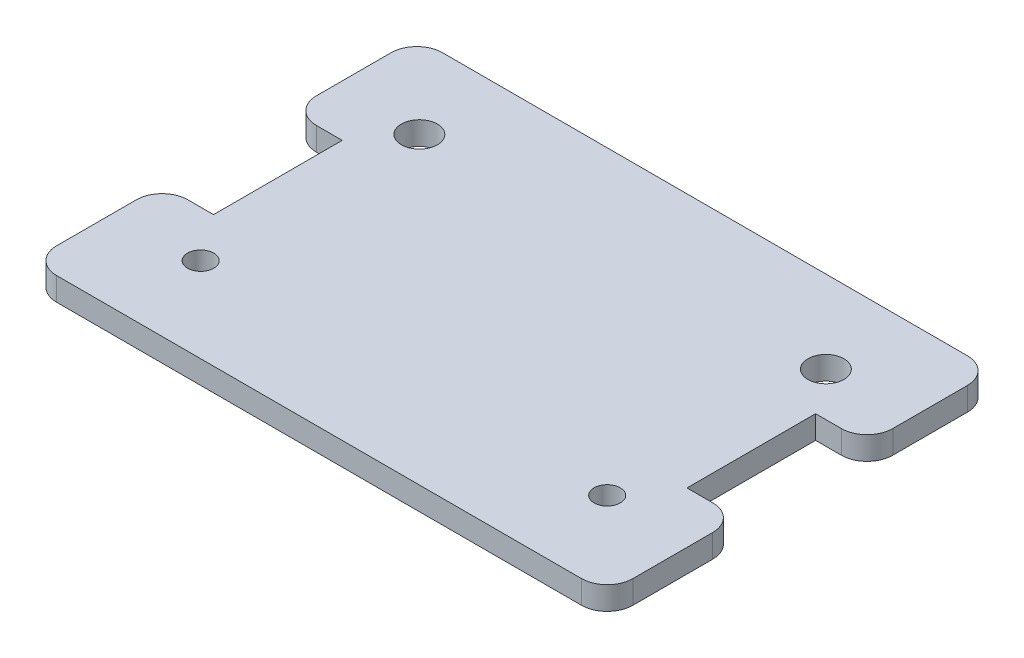
from build123d import *

# Parameters (mm, degrees)
SKETCH1_W           = 112
SKETCH1_H           = 75
BOSS_EXTRUDE1_DEPTH = 4.5
SKETCH2_R           = 2.55
SKETCH2_R_2         = 3.5
SKETCH2_W           = 10
SKETCH2_H           = 25
CUT_EXTRUDE1_DEPTH  = 135.867527597
FILLET1_R           = 5


with BuildPart() as part:
    # Sketch1 → Boss-Extrude1 (new body)
    with BuildSketch(Plane(origin=(0, 0, 0), x_dir=(1, 0, 0), z_dir=(0, 1, 0))):
        with Locations((56, 37.5)):
            Rectangle(SKETCH1_W, SKETCH1_H)
    extrude(amount=BOSS_EXTRUDE1_DEPTH)

    # Sketch2 → Cut-Extrude1 (cut, through all)
    with BuildSketch(Plane(origin=(0, 4.5, 0), x_dir=(1, 0, 0), z_dir=(0, 1, 0))):
        with Locations(Location((95.5, 16.5, 0), (0, 0, 270))):
            Circle(SKETCH2_R)
        with Locations(Location((16.5, 16.5, 0), (0, 0, 270))):
            Circle(SKETCH2_R)
        with Locations(Location((16.5, 59, 0), (0, 0, 270))):
            Circle(SKETCH2_R_2)
        with Locations(Location((95.5, 59, 0), (0, 0, 270))):
            Circle(SKETCH2_R_2)
        with Locations((5, 38)):
            Rectangle(SKETCH2_W, SKETCH2_H)
        with Locations((107, 38)):
            Rectangle(SKETCH2_W, SKETCH2_H)
    extrude(amount=-CUT_EXTRUDE1_DEPTH, mode=Mode.SUBTRACT)

    # Fillet1
    fillet1_edges = [part.edges().sort_by_distance(p)[0] for p in [
        (112, 2.25, -50.5),
        (112, 2.25, -25.5),
        (0, 2.25, -25.5),
        (0, 2.25, -50.5),
        (0, 2.25, -75),
        (112, 2.25, -75),
        (112, 2.25, 0),
        (0, 2.25, 0),
    ]]
    fillet(fillet1_edges, radius=FILLET1_R)


solid = part.part
